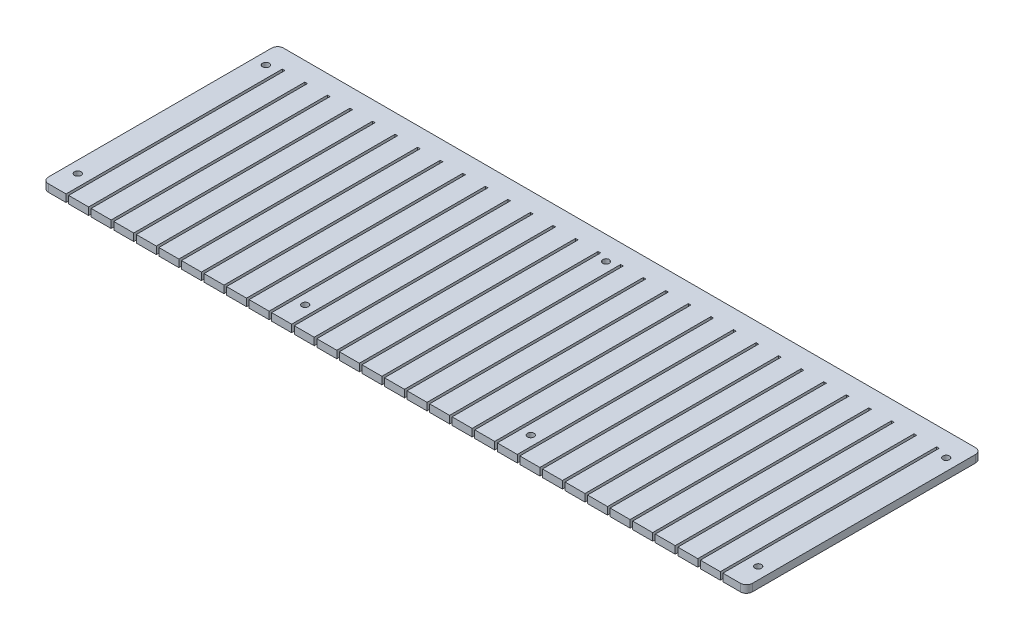
from build123d import *

# Parameters (mm, degrees)
SKETCH3_R           = 1.4
BOSS_EXTRUDE1_DEPTH = 3.175


with BuildPart() as part:
    # Sketch3 → Boss-Extrude1 (new body)
    with BuildSketch(Plane(origin=(0, 0, 0), x_dir=(1, 0, 0), z_dir=(0, 1, 0))):
        with BuildLine():
            Line((-72.55, 42), (-71.45, 42))
            Line((-71.45, 42), (-71.45, -50))
            Line((-71.45, -50), (-62.95, -50))
            Line((-62.95, -50), (-62.95, 42))
            Line((-62.95, 42), (-61.85, 42))
            Line((-61.85, 42), (-61.85, -50))
            Line((-61.85, -50), (-53.35, -50))
            Line((-53.35, -50), (-53.35, 42))
            Line((-53.35, 42), (-52.25, 42))
            Line((-52.25, 42), (-52.25, -50))
            Line((-52.25, -50), (-43.75, -50))
            Line((-43.75, -50), (-43.75, 42))
            Line((-43.75, 42), (-42.65, 42))
            Line((-42.65, 42), (-42.65, -50))
            Line((-42.65, -50), (-34.15, -50))
            Line((-34.15, -50), (-34.15, 42))
            Line((-34.15, 42), (-33.05, 42))
            Line((-33.05, 42), (-33.05, -50))
            Line((-33.05, -50), (-24.55, -50))
            Line((-24.55, -50), (-24.55, 42))
            Line((-24.55, 42), (-23.45, 42))
            Line((-23.45, 42), (-23.45, -50))
            Line((-23.45, -50), (-14.95, -50))
            Line((-14.95, -50), (-14.95, 42))
            Line((-14.95, 42), (-13.85, 42))
            Line((-13.85, 42), (-13.85, -50))
            Line((-13.85, -50), (-5.35, -50))
            Line((-5.35, -50), (-5.35, 42))
            Line((-5.35, 42), (-4.25, 42))
            Line((-4.25, 42), (-4.25, -50))
            Line((-4.25, -50), (4.25, -50))
            Line((4.25, -50), (4.25, 42))
            Line((4.25, 42), (5.35, 42))
            Line((5.35, 42), (5.35, -50))
            Line((5.35, -50), (13.85, -50))
            Line((13.85, -50), (13.85, 42))
            Line((13.85, 42), (14.95, 42))
            Line((14.95, 42), (14.95, -50))
            Line((14.95, -50), (23.45, -50))
            Line((23.45, -50), (23.45, 42))
            Line((23.45, 42), (24.55, 42))
            Line((24.55, 42), (24.55, -50))
            Line((24.55, -50), (33.05, -50))
            Line((33.05, -50), (33.05, 42))
            Line((33.05, 42), (34.15, 42))
            Line((34.15, 42), (34.15, -50))
            Line((34.15, -50), (42.65, -50))
            Line((42.65, -50), (42.65, 42))
            Line((42.65, 42), (43.75, 42))
            Line((43.75, 42), (43.75, -50))
            Line((43.75, -50), (52.25, -50))
            Line((52.25, -50), (52.25, 42))
            Line((52.25, 42), (53.35, 42))
            Line((53.35, 42), (53.35, -50))
            Line((53.35, -50), (61.85, -50))
            Line((61.85, -50), (61.85, 42))
            Line((61.85, 42), (62.95, 42))
            Line((62.95, 42), (62.95, -50))
            Line((62.95, -50), (71.45, -50))
            Line((71.45, -50), (71.45, 42))
            Line((71.45, 42), (72.55, 42))
            Line((72.55, 42), (72.55, -50))
            Line((72.55, -50), (81.05, -50))
            Line((81.05, -50), (81.05, 42))
            Line((81.05, 42), (82.15, 42))
            Line((82.15, 42), (82.15, -50))
            Line((82.15, -50), (90.65, -50))
            Line((90.65, -50), (90.65, 42))
            Line((90.65, 42), (91.75, 42))
            Line((91.75, 42), (91.75, -50))
            Line((91.75, -50), (100.25, -50))
            Line((100.25, -50), (100.25, 42))
            Line((100.25, 42), (101.35, 42))
            Line((101.35, 42), (101.35, -50))
            Line((101.35, -50), (109.85, -50))
            Line((109.85, -50), (109.85, 42))
            Line((109.85, 42), (110.95, 42))
            Line((110.95, 42), (110.95, -50))
            Line((110.95, -50), (119.45, -50))
            Line((119.45, -50), (119.45, 42))
            Line((119.45, 42), (120.55, 42))
            Line((120.55, 42), (120.55, -50))
            Line((120.55, -50), (129.05, -50))
            Line((129.05, -50), (129.05, 42))
            Line((129.05, 42), (130.15, 42))
            Line((130.15, 42), (130.15, -50))
            Line((130.15, -50), (138.65, -50))
            Line((138.65, -50), (138.65, 42))
            Line((138.65, 42), (139.75, 42))
            Line((139.75, 42), (139.75, -50))
            Line((139.75, -50), (147.25, -50))
            ThreePointArc((147.25, -50), (149.017766953, -49.267766953), (149.75, -47.5))
            Line((149.75, -47.5), (149.75, 47.5))
            ThreePointArc((149.75, 47.5), (149.017766953, 49.267766953), (147.25, 50))
            Line((147.25, 50), (-147.25, 50))
            ThreePointArc((-147.25, 50), (-149.017766953, 49.267766953), (-149.75, 47.5))
            Line((-149.75, 47.5), (-149.75, -47.5))
            ThreePointArc((-149.75, -47.5), (-149.017766953, -49.267766953), (-147.25, -50))
            Line((-147.25, -50), (-139.75, -50))
            Line((-139.75, -50), (-139.75, 42))
            Line((-139.75, 42), (-138.65, 42))
            Line((-138.65, 42), (-138.65, -50))
            Line((-138.65, -50), (-130.15, -50))
            Line((-130.15, -50), (-130.15, 42))
            Line((-130.15, 42), (-129.05, 42))
            Line((-129.05, 42), (-129.05, -50))
            Line((-129.05, -50), (-120.55, -50))
            Line((-120.55, -50), (-120.55, 42))
            Line((-120.55, 42), (-119.45, 42))
            Line((-119.45, 42), (-119.45, -50))
            Line((-119.45, -50), (-110.95, -50))
            Line((-110.95, -50), (-110.95, 42))
            Line((-110.95, 42), (-109.85, 42))
            Line((-109.85, 42), (-109.85, -50))
            Line((-109.85, -50), (-101.35, -50))
            Line((-101.35, -50), (-101.35, 42))
            Line((-101.35, 42), (-100.25, 42))
            Line((-100.25, 42), (-100.25, -50))
            Line((-100.25, -50), (-91.75, -50))
            Line((-91.75, -50), (-91.75, 42))
            Line((-91.75, 42), (-90.65, 42))
            Line((-90.65, 42), (-90.65, -50))
            Line((-90.65, -50), (-82.15, -50))
            Line((-82.15, -50), (-82.15, 42))
            Line((-82.15, 42), (-81.05, 42))
            Line((-81.05, 42), (-81.05, -50))
            Line((-81.05, -50), (-72.55, -50))
            Line((-72.55, -50), (-72.55, 42))
        make_face()
        with Locations(Location((-144.75, -40, 0), (0, 0, 270))):
            Circle(SKETCH3_R, mode=Mode.SUBTRACT)
        with Locations(Location((-48, -40, 0), (0, 0, 270))):
            Circle(SKETCH3_R, mode=Mode.SUBTRACT)
        with Locations(Location((48, -40, 0), (0, 0, 270))):
            Circle(SKETCH3_R, mode=Mode.SUBTRACT)
        with Locations(Location((144.75, -40, 0), (0, 0, 270))):
            Circle(SKETCH3_R, mode=Mode.SUBTRACT)
        with Locations(Location((-144.75, 40, 0), (0, 0, 270))):
            Circle(SKETCH3_R, mode=Mode.SUBTRACT)
        with Locations(Location((0, 40, 0), (0, 0, 270))):
            Circle(SKETCH3_R, mode=Mode.SUBTRACT)
        with Locations(Location((144.75, 40, 0), (0, 0, 270))):
            Circle(SKETCH3_R, mode=Mode.SUBTRACT)
    extrude(amount=BOSS_EXTRUDE1_DEPTH)


solid = part.part
